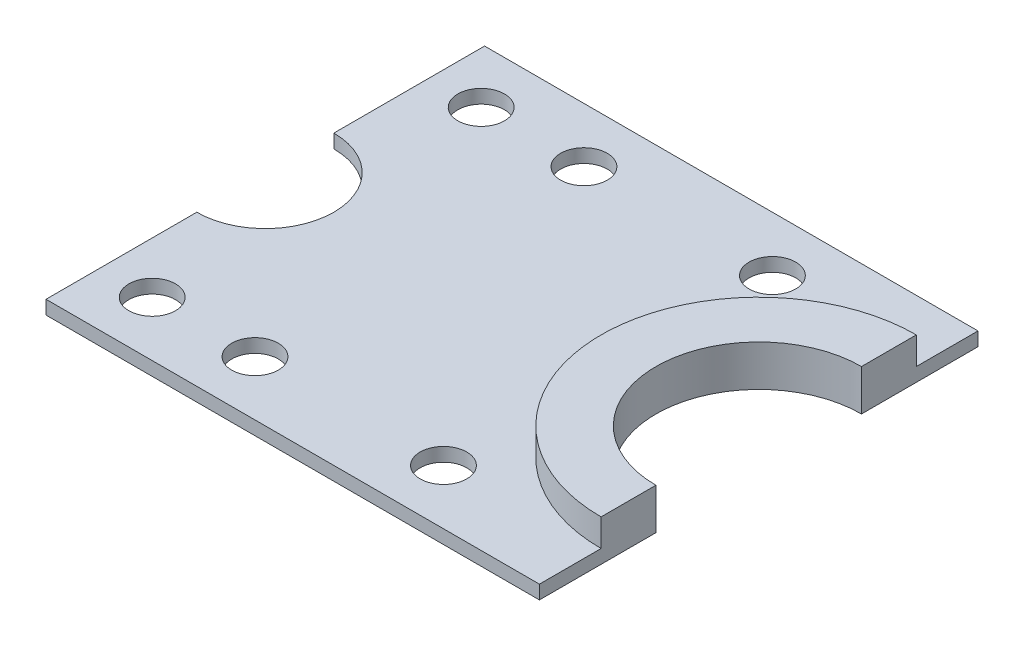
from build123d import *
from build123d.topology import SkipClean

# Parameters (mm, degrees)
SKETCH1_W           = 36
SKETCH1_H           = 32
BOSS_EXTRUDE1_DEPTH = 1
SKETCH2_R           = 1.7
SKETCH2_R_2         = 7.5
SKETCH2_R_3         = 5
CUT_EXTRUDE1_DEPTH  = 1
BOSS_EXTRUDE2_START = 2
BOSS_EXTRUDE2_DEPTH = 2


with BuildPart() as part:
    # Sketch1 → Boss-Extrude1 (new body)
    with BuildSketch(Plane(origin=(0, 0, 0), x_dir=(1, 0, 0), z_dir=(0, 1, 0))):
        with Locations((18, 16)):
            Rectangle(SKETCH1_W, SKETCH1_H)
    extrude(amount=BOSS_EXTRUDE1_DEPTH)

    # Sketch2 → Cut-Extrude1 (cut)
    with BuildSketch(Plane(origin=(0, 1, 0), x_dir=(1, 0, 0), z_dir=(0, 1, 0))):
        with Locations(Location((3.75, 28, 0), (0, 0, 270))):
            Circle(SKETCH2_R)
        with Locations(Location((11.25, 28, 0), (0, 0, 270))):
            Circle(SKETCH2_R)
        with Locations(Location((25, 28, 0), (0, 0, 270))):
            Circle(SKETCH2_R)
        with Locations((36, 16)):
            Circle(SKETCH2_R_2)
        with Locations(Location((25, 4, 0), (0, 0, 90))):
            Circle(SKETCH2_R)
        with Locations(Location((11.25, 4, 0), (0, 0, 90))):
            Circle(SKETCH2_R)
        with Locations(Location((3.75, 4, 0), (0, 0, 90))):
            Circle(SKETCH2_R)
        with Locations((0, 16)):
            Circle(SKETCH2_R_3)
    extrude(amount=-CUT_EXTRUDE1_DEPTH, mode=Mode.SUBTRACT)

    # Sketch3 → Boss-Extrude2 (add)
    with SkipClean():  # the faces are left unmerged after this step: merging them gives an invalid solid
        with BuildSketch(Plane(origin=(0, 1, 0), x_dir=(1, 0, 0), z_dir=(0, 1, 0)).offset(BOSS_EXTRUDE2_START)):
            with BuildLine():
                Line((36, 23.5), (36, 27.5))
                ThreePointArc((36, 27.5), (24.5, 16), (36, 4.5))
                Line((36, 4.5), (36, 8.5))
                ThreePointArc((36, 8.5), (28.5, 16), (36, 23.5))
            make_face()
        extrude(amount=-BOSS_EXTRUDE2_DEPTH)


solid = part.part
